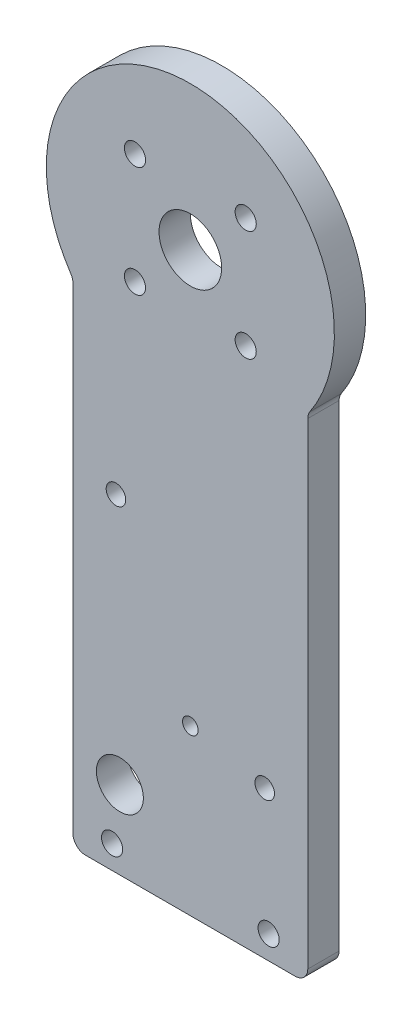
from build123d import *

# Parameters (mm, degrees)
CROQUIS1_R              = 1.35
CROQUIS1_R_2            = 4
CROQUIS1_R_3            = 1.25
SALIENTE_EXTRUIR1_DEPTH = 4
REDONDEO1_R             = 1.6
CROQUIS2_R              = 1
CROQUIS2_R_2            = 3
CORTAR_EXTRUIR1_DEPTH   = 4


with BuildPart() as part:
    # Croquis1 → Saliente-Extruir1 (new body)
    with BuildSketch(Plane.XY):
        with BuildLine():
            Line((-15, -10.656453444), (-15, -73.656453444))
            Line((-15, -73.656453444), (15, -73.656453444))
            Line((15, -73.656453444), (15, -10.656453444))
            ThreePointArc((15, -10.656453444), (0, 18.4), (-15, -10.656453444))
        make_face()
        with Locations((-7.071067812, -7.071067812)):
            Circle(CROQUIS1_R, mode=Mode.SUBTRACT)
        with Locations((-7.071067812, 7.071067812)):
            Circle(CROQUIS1_R, mode=Mode.SUBTRACT)
        with Locations((7.071067812, 7.071067812)):
            Circle(CROQUIS1_R, mode=Mode.SUBTRACT)
        with Locations((7.071067812, -7.071067812)):
            Circle(CROQUIS1_R, mode=Mode.SUBTRACT)
        Circle(CROQUIS1_R_2, mode=Mode.SUBTRACT)
        with Locations((-10, -70.656453444)):
            Circle(CROQUIS1_R, mode=Mode.SUBTRACT)
        with Locations(Location((10, -70.656453444, 0), (0, 0, 180))):
            Circle(CROQUIS1_R, mode=Mode.SUBTRACT)
        with Locations((9.5, -54.791192074)):
            Circle(CROQUIS1_R_3, mode=Mode.SUBTRACT)
        with Locations((-9.5, -31.791192074)):
            Circle(CROQUIS1_R_3, mode=Mode.SUBTRACT)
    extrude(amount=SALIENTE_EXTRUIR1_DEPTH)

    # Redondeo1
    redondeo1_edges = [part.edges().sort_by_distance(p)[0] for p in [
        (15, -10.656453444, 2),
        (15, -73.656453444, 2),
        (-15, -73.656453444, 2),
        (-15, -10.656453444, 2),
    ]]
    fillet(redondeo1_edges, radius=REDONDEO1_R)

    # Croquis2 → Cortar-Extruir1 (cut)
    with BuildSketch(Plane.XY.offset(4)):
        with Locations((0, -52.656453444)):
            Circle(CROQUIS2_R)
        with Locations((-9, -63.656453444)):
            Circle(CROQUIS2_R_2)
    extrude(amount=-CORTAR_EXTRUIR1_DEPTH, mode=Mode.SUBTRACT)


solid = part.part
